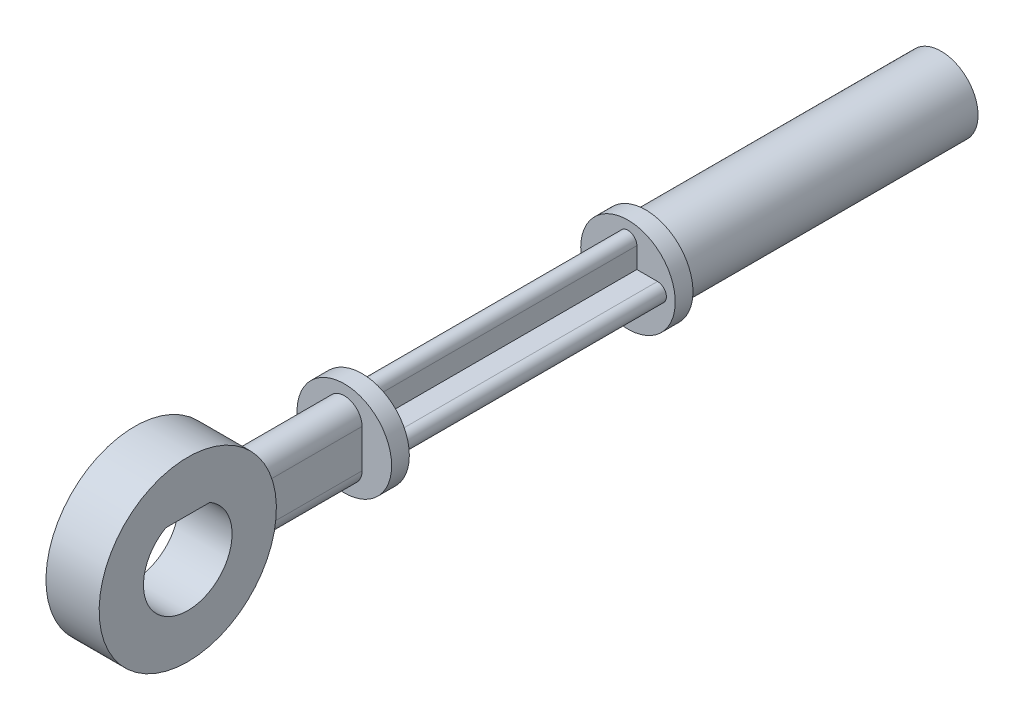
from build123d import *

# Parameters (mm, degrees)
SKETCH1_R           = 16
BASE_EXTRUDE_DEPTH  = 3
EXTRUDE3_DEPTH      = 62
BOSS_EXTRUDE1_DEPTH = 90
SKETCH6_R           = 16
BOSS_EXTRUDE2_DEPTH = 6
SKETCH9_W           = 18
SKETCH9_H           = 30
CUT_EXTRUDE1_DEPTH  = 107.423681603
SKETCH7_R           = 12.5
EXTRUDE4_DEPTH      = 100


with BuildPart() as part:
    # Sketch1 → Base-Extrude (new, symmetric)
    with BuildSketch(Plane.XY):
        Circle(SKETCH1_R)
    extrude(amount=BASE_EXTRUDE_DEPTH, both=True)

    # Sketch2 → Extrude3 (add)
    with BuildSketch(Plane.XY.offset(3)):
        with BuildLine():
            Line((6, 6.5), (6, -6.5))
            ThreePointArc((6, -6.5), (0, -12.5), (-6, -6.5))
            Line((-6, -6.5), (-6, 6.5))
            ThreePointArc((-6, 6.5), (0, 12.5), (6, 6.5))
        make_face()
    extrude(amount=EXTRUDE3_DEPTH)

    # Sketch5 → Boss-Extrude1 (add)
    with BuildSketch(Plane(origin=(0, 0, -3), x_dir=(-1, 0, 0), z_dir=(0, 0, -1))):
        with BuildLine():
            Line((-3, 3), (-3, 10))
            ThreePointArc((-3, 10), (0, 13), (3, 10))
            Line((3, 10), (3, 3))
            Line((3, 3), (10, 3))
            ThreePointArc((10, 3), (13, 0), (10, -3))
            Line((10, -3), (3, -3))
            Line((3, -3), (3, -10))
            ThreePointArc((3, -10), (0, -13), (-3, -10))
            Line((-3, -10), (-3, -3))
            Line((-3, -3), (-10, -3))
            ThreePointArc((-10, -3), (-13, 0), (-10, 3))
            Line((-10, 3), (-3, 3))
        make_face()
    extrude(amount=BOSS_EXTRUDE1_DEPTH)

    # Sketch6 → Boss-Extrude2 (add)
    with BuildSketch(Plane(origin=(0, 0, -93), x_dir=(-1, 0, 0), z_dir=(0, 0, -1))):
        with Locations(Location((0, 0, 0), (0, 0, 180))):
            Circle(SKETCH6_R)
    extrude(amount=BOSS_EXTRUDE2_DEPTH)

    # Sketch9 → Boss-Revolve1 (revolve)
    with BuildSketch(Plane.XY.offset(65), mode=Mode.PRIVATE) as boss_revolve1_sk:
        with Locations((0, 15)):
            Rectangle(SKETCH9_W, SKETCH9_H)
    revolve(boss_revolve1_sk.sketch.rotate(Axis((9, 0, 65), (1, 0, 0)), 180), axis=Axis((9, 0, 65), (1, 0, 0)))

    # Sketch10 → Cut-Extrude1 (cut, through all)
    with BuildSketch(Plane(origin=(9, 0, 0), x_dir=(0, 0, -1), z_dir=(1, 0, 0))):
        with BuildLine():
            Line((-72.483314774, 13), (-57.516685226, 13))
            ThreePointArc((-57.516685226, 13), (-65, -15), (-72.483314774, 13))
        make_face()
    extrude(amount=-CUT_EXTRUDE1_DEPTH, mode=Mode.SUBTRACT)

    # Sketch7 → Extrude4 (add)
    with BuildSketch(Plane(origin=(0, 0, -99), x_dir=(-1, 0, 0), z_dir=(0, 0, -1))):
        Circle(SKETCH7_R)
    extrude(amount=EXTRUDE4_DEPTH)


solid = part.part
